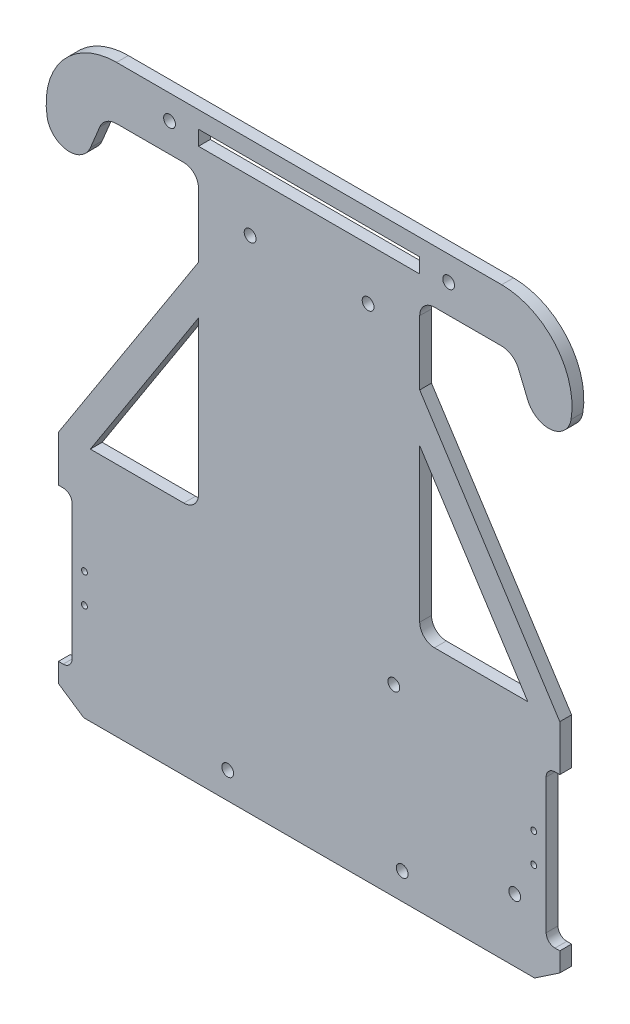
from build123d import *

# Parameters (mm, degrees)
BOSS_EXTRUDE1_DEPTH = 4
SKETCH3_R           = 2
CUT_EXTRUDE1_DEPTH  = 10
CUT_EXTRUDE2_DEPTH  = 10
SKETCH5_W           = 37.5
SKETCH5_H           = 5
SKETCH5_R           = 2
CUT_EXTRUDE3_DEPTH  = 10
SKETCH6_R           = 2
CUT_EXTRUDE4_DEPTH  = 10
SKETCH7_R           = 1
CUT_EXTRUDE5_DEPTH  = 10
SKETCH8_R           = 2
CUT_EXTRUDE6_DEPTH  = 10


with BuildPart() as part:
    # Sketch1 → Boss-Extrude1 (new body)
    # profile 1 of 2: a face of its own
    with BuildSketch(Plane.XY):
        with BuildLine():
            Line((0, -57.20543624), (0, 140.79456376))
            Line((0, 140.79456376), (-50, 140.79456376))
            Line((-50, 140.79456376), (-65.293896859, 140.79456376))
            ThreePointArc((-65.293896859, 140.79456376), (-83.510437362, 132.343917874), (-88.822955159, 112.978151212))
            ThreePointArc((-88.822955159, 112.978151212), (-82.121571276, 106.62300147), (-74.161000128, 111.305498795))
            Line((-74.161000128, 111.305498795), (-70.965431907, 118.996456291))
            ThreePointArc((-70.965431907, 118.996456291), (-68.695430494, 121.757834263), (-65.274420897, 122.79456376))
            Line((-65.274420897, 122.79456376), (-50.707299907, 122.79456376))
            Line((-50.707299907, 122.79456376), (-42.5, 122.79456376))
            ThreePointArc((-42.5, 122.79456376), (-38.964466094, 121.330097666), (-37.5, 117.79456376))
            Line((-37.5, 117.79456376), (-37.5, 95.998067584))
            Line((-37.5, 95.998067584), (-85, 22.344598664))
            Line((-85, 22.344598664), (-85, -51.456618505))
            Line((-85, -51.456618505), (-76.438195827, -57.20543624))
            Line((-76.438195827, -57.20543624), (0, -57.20543624))
        make_face()
        with BuildLine():
            ThreePointArc((-37.5, 27.79456376), (-38.964466094, 24.259029854), (-42.5, 22.79456376))
            Line((-42.5, 22.79456376), (-74.161000128, 22.79456376))
            Line((-74.161000128, 22.79456376), (-37.5, 79.641086571))
            Line((-37.5, 79.641086571), (-37.5, 27.79456376))
        make_face(mode=Mode.SUBTRACT)
    # profile 2 of 2: a face of its own
    with BuildSketch(Plane.XY):
        with BuildLine():
            Line((65.293896859, 140.79456376), (50, 140.79456376))
            Line((50, 140.79456376), (0, 140.79456376))
            Line((0, 140.79456376), (0, -57.20543624))
            Line((0, -57.20543624), (76.438195827, -57.20543624))
            Line((76.438195827, -57.20543624), (85, -51.456618505))
            Line((85, -51.456618505), (85, 22.344598664))
            Line((85, 22.344598664), (37.5, 95.998067584))
            Line((37.5, 95.998067584), (37.5, 117.79456376))
            ThreePointArc((37.5, 117.79456376), (38.964466094, 121.330097666), (42.5, 122.79456376))
            Line((42.5, 122.79456376), (50.707299907, 122.79456376))
            Line((50.707299907, 122.79456376), (65.274420897, 122.79456376))
            ThreePointArc((65.274420897, 122.79456376), (68.695430494, 121.757834263), (70.965431907, 118.996456291))
            Line((70.965431907, 118.996456291), (74.161000128, 111.305498795))
            ThreePointArc((74.161000128, 111.305498795), (82.121571276, 106.62300147), (88.822955159, 112.978151212))
            ThreePointArc((88.822955159, 112.978151212), (83.510437362, 132.343917874), (65.293896859, 140.79456376))
        make_face()
        with BuildLine():
            Line((37.5, 79.641086571), (74.161000128, 22.79456376))
            Line((74.161000128, 22.79456376), (42.5, 22.79456376))
            ThreePointArc((42.5, 22.79456376), (38.964466094, 24.259029854), (37.5, 27.79456376))
            Line((37.5, 27.79456376), (37.5, 79.641086571))
        make_face(mode=Mode.SUBTRACT)
    extrude(amount=BOSS_EXTRUDE1_DEPTH)

    # Sketch3 → Cut-Extrude1 (cut)
    with BuildSketch(Plane.XY.offset(4)):
        with Locations((-47.324700565, 132.53476761)):
            Circle(SKETCH3_R)
        with Locations((47.324700565, 132.53476761)):
            Circle(SKETCH3_R)
    extrude(amount=-CUT_EXTRUDE1_DEPTH, mode=Mode.SUBTRACT)

    # Sketch4 → Cut-Extrude2 (cut)
    with BuildSketch(Plane.XY.offset(4)):
        with BuildLine():
            Line((-99.472025614, 6.792585345), (-83.380037388, 6.792585345))
            ThreePointArc((-83.380037388, 6.792585345), (-81.258717044, 5.913905689), (-80.380037388, 3.792585345))
            Line((-80.380037388, 3.792585345), (-80.380037388, -41.949469703))
            ThreePointArc((-80.380037388, -41.949469703), (-81.258717044, -44.070790047), (-83.380037388, -44.949469703))
            Line((-83.380037388, -44.949469703), (-99.472025614, -44.949469703))
            Line((-99.472025614, -44.949469703), (-99.472025614, 6.792585345))
        make_face()
        with BuildLine():
            Line((99.472025614, -44.949469703), (83.380037388, -44.949469703))
            ThreePointArc((83.380037388, -44.949469703), (81.258717044, -44.070790047), (80.380037388, -41.949469703))
            Line((80.380037388, -41.949469703), (80.380037388, 3.792585345))
            ThreePointArc((80.380037388, 3.792585345), (81.258717044, 5.913905689), (83.380037388, 6.792585345))
            Line((83.380037388, 6.792585345), (99.472025614, 6.792585345))
            Line((99.472025614, 6.792585345), (99.472025614, -44.949469703))
        make_face()
    extrude(amount=-CUT_EXTRUDE2_DEPTH, mode=Mode.SUBTRACT)

    # Sketch5 → Cut-Extrude3 (cut)
    with BuildSketch(Plane.XY.offset(4)):
        with Locations((-18.75, 132.551936771)):
            Rectangle(SKETCH5_W, SKETCH5_H)
        with Locations((18.75, 132.551936771)):
            Rectangle(SKETCH5_W, SKETCH5_H)
        with Locations((20, 112.567697597)):
            Circle(SKETCH5_R)
        with Locations((-20, 112.567697597)):
            Circle(SKETCH5_R)
    extrude(amount=-CUT_EXTRUDE3_DEPTH, mode=Mode.SUBTRACT)

    # Sketch6 → Cut-Extrude4 (cut)
    with BuildSketch(Plane.XY.offset(4)):
        with Locations((28.728783517, 5.096950375)):
            Circle(SKETCH6_R)
        with Locations((69.728783517, -35.903049625)):
            Circle(SKETCH6_R)
    extrude(amount=-CUT_EXTRUDE4_DEPTH, mode=Mode.SUBTRACT)

    # Sketch7 → Cut-Extrude5 (cut)
    with BuildSketch(Plane.XY.offset(4)):
        with Locations((-76.177192192, -14.107414655)):
            Circle(SKETCH7_R)
        with Locations((-76.177192192, -24.107414655)):
            Circle(SKETCH7_R)
        with Locations((76.177192192, -24.107414655)):
            Circle(SKETCH7_R)
        with Locations((76.177192192, -14.107414655)):
            Circle(SKETCH7_R)
    extrude(amount=-CUT_EXTRUDE5_DEPTH, mode=Mode.SUBTRACT)

    # Sketch8 → Cut-Extrude6 (cut)
    with BuildSketch(Plane.XY.offset(4)):
        with Locations((-27.6, -48.199469703)):
            Circle(SKETCH8_R)
        with Locations((31.57, -48.199469703)):
            Circle(SKETCH8_R)
    extrude(amount=-CUT_EXTRUDE6_DEPTH, mode=Mode.SUBTRACT)


solid = part.part
